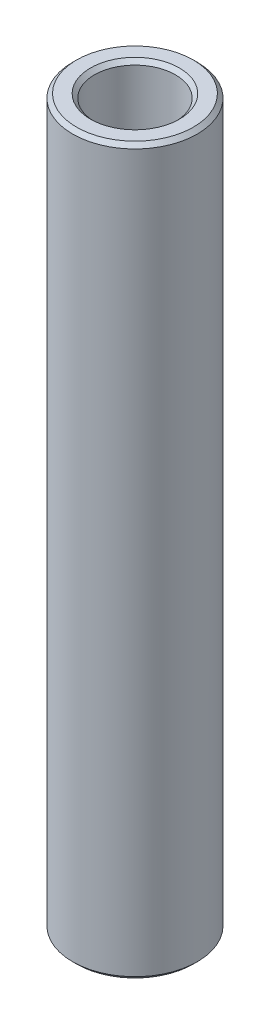
from build123d import *

# Parameters (mm, degrees)
SKETCH1_W     = 0.7
SKETCH1_H     = 23.27402
CHAMFER1_SIZE = 0.127


with BuildPart() as part:
    # Sketch1 → Revolve1 (revolve)
    with BuildSketch(Plane.XY, mode=Mode.PRIVATE) as revolve1_sk:
        with Locations((1.65, 0)):
            Rectangle(SKETCH1_W, SKETCH1_H)
    revolve(revolve1_sk.sketch.rotate(Axis((0, 9.615558323, 0), (0, -1, 0)), 90), axis=Axis((0, 9.615558323, 0), (0, -1, 0)))

    # Chamfer1
    chamfer1_edges = [part.edges().sort_by_distance(p)[0] for p in [
        (0, 11.63701, -1.3),
        (0, 11.63701, -2),
        (0, -11.63701, -2),
        (0, -11.63701, -1.3),
    ]]
    chamfer(chamfer1_edges, length=CHAMFER1_SIZE)


solid = part.part
